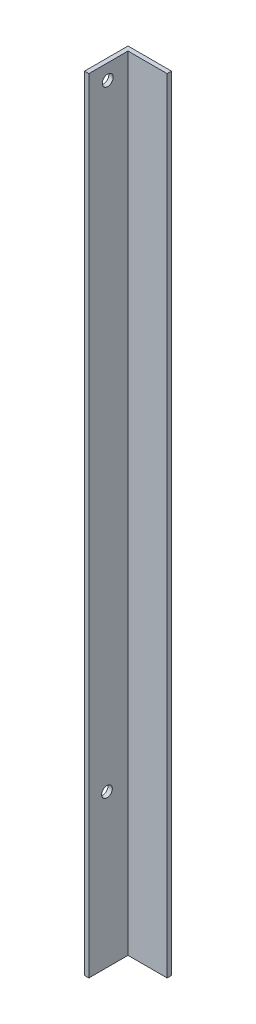
from build123d import *

# Parameters (mm, degrees)
EXTRUDE_THIN1_DEPTH = 457.2
SKETCH3_R           = 3.175
CUT_EXTRUDE1_DEPTH  = 459.108462592
SKETCH4_R           = 3.111919631
CUT_EXTRUDE2_DEPTH  = 459.108462592


with BuildPart() as part:
    # Sketch1 → Extrude-Thin1 (new body)
    with BuildSketch(Plane(origin=(0, 0, 0), x_dir=(1, 0, 0), z_dir=(0, 1, 0))):
        Polygon((-24.9936, -7.8232), (-24.9936, 17.5768), (0.4064, 17.5768), (0.4064, 15.0368), (-22.4536, 15.0368), (-22.4536, -7.8232), align=None)
    extrude(amount=EXTRUDE_THIN1_DEPTH)

    # Sketch3 → Cut-Extrude1 (cut, through all)
    with BuildSketch(Plane(origin=(-22.4536, 0, 0), x_dir=(0, 0, -1), z_dir=(1, 0, 0))):
        with Locations((3.205834921, 448.31)):
            Circle(SKETCH3_R)
    extrude(amount=-CUT_EXTRUDE1_DEPTH, mode=Mode.SUBTRACT)

    # Sketch4 → Cut-Extrude2 (cut, through all)
    with BuildSketch(Plane(origin=(-22.4536, 0, 0), x_dir=(0, 0, -1), z_dir=(1, 0, 0))):
        with Locations((2.761783971, 88.9)):
            Circle(SKETCH4_R)
    extrude(amount=-CUT_EXTRUDE2_DEPTH, mode=Mode.SUBTRACT)


solid = part.part
